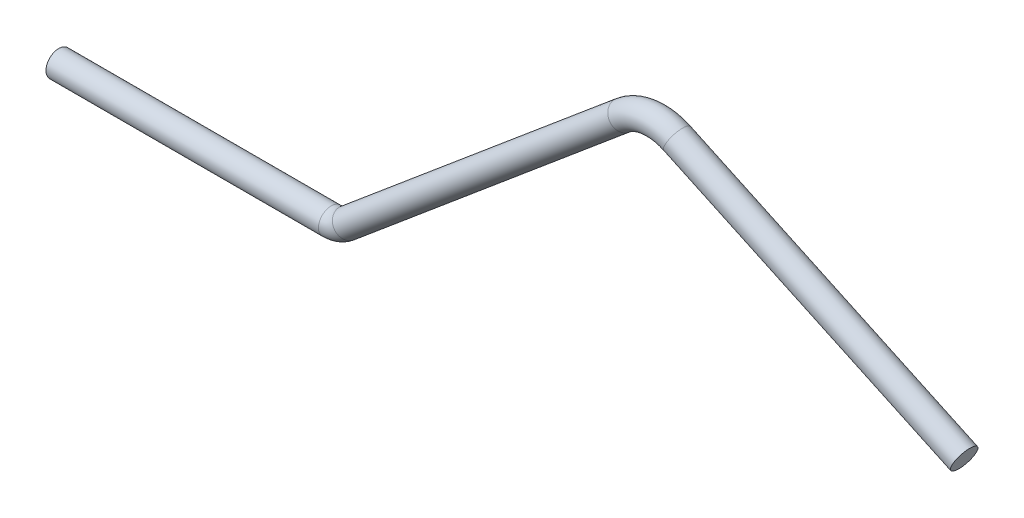
from build123d import *

# Parameters (mm, degrees)
ESQUISSE2_R        = 2
ESQUISSE2_2_R      = 2
BOSS_EXTRU_1_DEPTH = 30


with BuildPart() as part:
    # Balayage1: sweep along a path in Esquisse1
    with BuildLine(Plane.XY) as balayage1_path:
        Line((0, 0), (12.816178594, 0))
        ThreePointArc((12.816178594, 0), (14.868299454, 0.361844275), (16.672904253, 1.403733341))
        Line((16.672904253, 1.403733341), (59.940468109, 37.709530215))
        ThreePointArc((59.940468109, 37.709530215), (63.014036614, 39.061932725), (66.332903338, 38.551110279))
        Line((66.332903338, 38.551110279), (111.436464109, 17.518974481))
    # Esquisse2 → Balayage1 (sweep)
    with BuildSketch(Plane(origin=(0, 0, 0), x_dir=(0, 0, -1), z_dir=(1, 0, 0))):
        with Locations((0, 2)):
            Circle(ESQUISSE2_R)
    sweep(path=balayage1_path.line)

    # Esquisse2<2> → Boss.-Extru.1 (add)
    with BuildSketch(Plane(origin=(0, 0, 0), x_dir=(0, 0, -1), z_dir=(1, 0, 0))):
        with Locations((0, 2)):
            Circle(ESQUISSE2_2_R)
    extrude(amount=-BOSS_EXTRU_1_DEPTH)


solid = part.part
